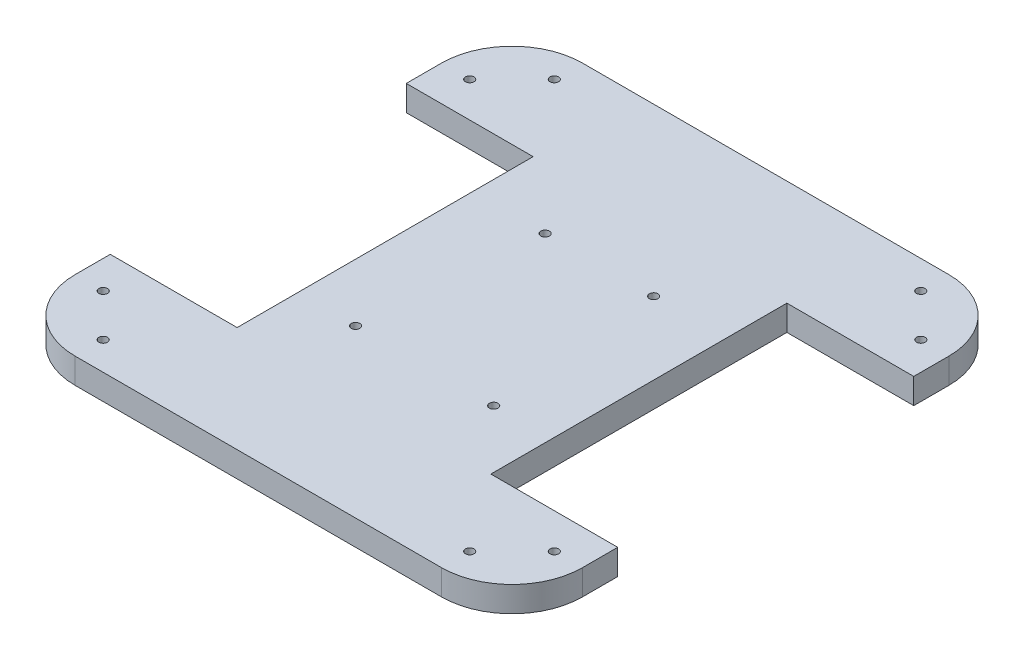
from build123d import *

# Parameters (mm, degrees)
PLATE_DEPTH         = 9
SKETCH3_R           = 1.525
HEX_HOLES_DEPTH     = 128.597021909
SKETCH4_R           = 1.525
ARDUINO_HOLES_DEPTH = 128.597021909
SKETCH5_W           = 45
SKETCH5_H           = 105
CUT_EXTRUDE1_DEPTH  = 128.597021909


with BuildPart() as part:
    # Sketch1 → Plate (new body)
    with BuildSketch(Plane(origin=(0, 0, 0), x_dir=(1, 0, 0), z_dir=(0, 1, 0))):
        with BuildLine():
            Line((-65, -90), (65, -90))
            ThreePointArc((65, -90), (82.67766953, -82.67766953), (90, -65))
            Line((90, -65), (90, 65))
            ThreePointArc((90, 65), (82.67766953, 82.67766953), (65, 90))
            Line((65, 90), (-65, 90))
            ThreePointArc((-65, 90), (-82.67766953, 82.67766953), (-90, 65))
            Line((-90, 65), (-90, -65))
            ThreePointArc((-90, -65), (-82.67766953, -82.67766953), (-65, -90))
        make_face()
    extrude(amount=PLATE_DEPTH)

    # Sketch3 → Hex Holes (cut, through all)
    with BuildSketch(Plane(origin=(0, 9, 0), x_dir=(1, 0, 0), z_dir=(0, 1, 0))):
        with Locations(Location((-65, 80, 0), (0, 0, 270))):
            Circle(SKETCH3_R)
        with Locations(Location((-80, 65, 0), (0, 0, 270))):
            Circle(SKETCH3_R)
        with Locations(Location((80, 65, 0), (0, 0, 270))):
            Circle(SKETCH3_R)
        with Locations(Location((80, -65, 0), (0, 0, 270))):
            Circle(SKETCH3_R)
        with Locations(Location((65, 80, 0), (0, 0, 270))):
            Circle(SKETCH3_R)
        with Locations(Location((65, -80, 0), (0, 0, 270))):
            Circle(SKETCH3_R)
        with Locations(Location((-65, -80, 0), (0, 0, 270))):
            Circle(SKETCH3_R)
        with Locations(Location((-80, -65, 0), (0, 0, 270))):
            Circle(SKETCH3_R)
    extrude(amount=-HEX_HOLES_DEPTH, mode=Mode.SUBTRACT)

    # Sketch4 → Arduino Holes (cut, through all)
    with BuildSketch(Plane(origin=(0, 9, 0), x_dir=(1, 0, 0), z_dir=(0, 1, 0))):
        with Locations(Location((-24.5, -31, 0), (0, 0, 270))):
            Circle(SKETCH4_R)
        with Locations(Location((24.5, -31, 0), (0, 0, 270))):
            Circle(SKETCH4_R)
        with Locations(Location((-19.25, 31, 0), (0, 0, 270))):
            Circle(SKETCH4_R)
        with Locations(Location((19.25, 31, 0), (0, 0, 270))):
            Circle(SKETCH4_R)
    extrude(amount=-ARDUINO_HOLES_DEPTH, mode=Mode.SUBTRACT)

    # Sketch5 → Cut-Extrude1 (cut, through all)
    with BuildSketch(Plane(origin=(0, 9, 0), x_dir=(1, 0, 0), z_dir=(0, 1, 0))):
        with Locations((-67.5, 0)):
            Rectangle(SKETCH5_W, SKETCH5_H)
        with Locations((67.5, 0)):
            Rectangle(SKETCH5_W, SKETCH5_H)
    extrude(amount=-CUT_EXTRUDE1_DEPTH, mode=Mode.SUBTRACT)


solid = part.part
